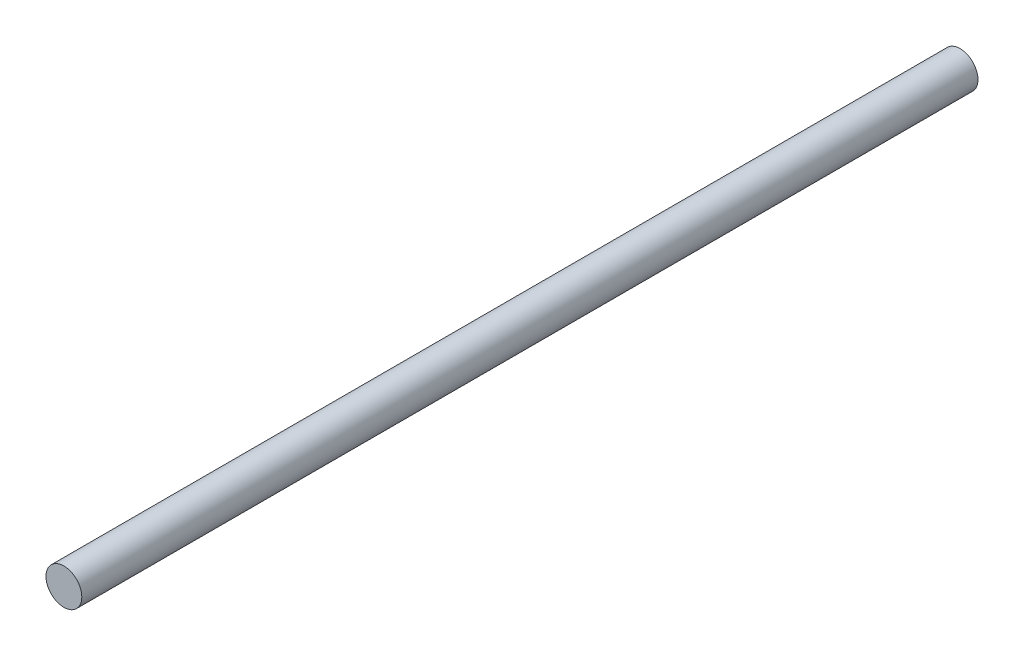
from build123d import *

# Parameters (mm, degrees)
ESQUISSE1_R        = 4
BOSS_EXTRU_1_DEPTH = 200


with BuildPart() as part:
    # Esquisse1 → Boss.-Extru.1 (new body)
    with BuildSketch(Plane.XY):
        Circle(ESQUISSE1_R)
    extrude(amount=BOSS_EXTRU_1_DEPTH)


solid = part.part
